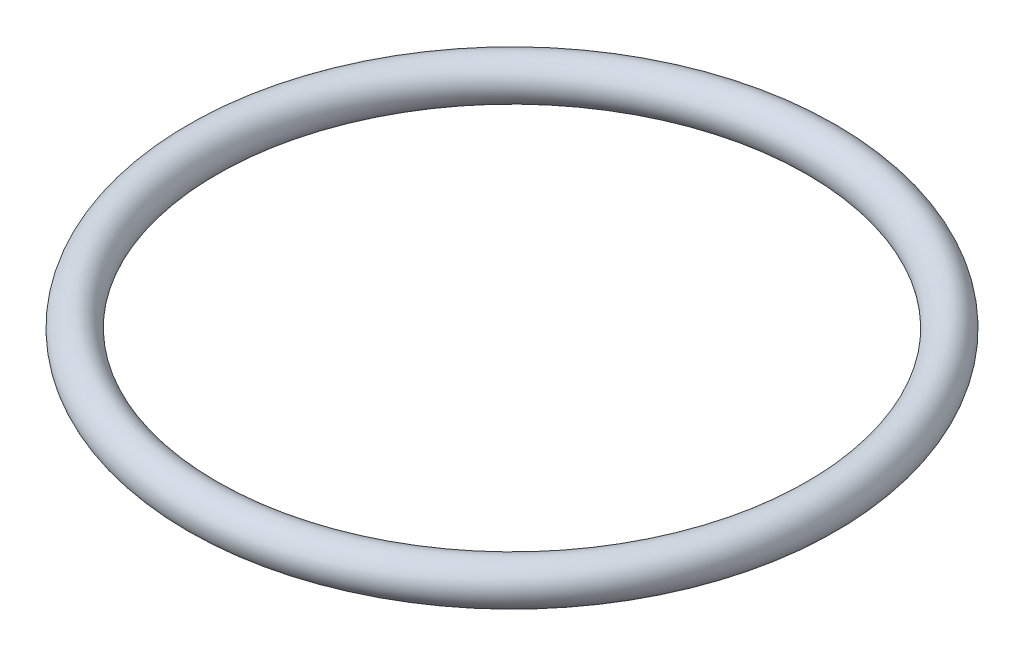
from build123d import *

# Parameters (mm, degrees)
SKETCH_1_R = 2


with BuildPart() as part:
    # ｽｹｯﾁ1 → 回転1 (revolve)
    with BuildSketch(Plane.XY, mode=Mode.PRIVATE) as revolve_1_sk:
        with Locations((30.5, 0)):
            Circle(SKETCH_1_R)
    revolve(revolve_1_sk.sketch.rotate(Axis((0, 0, 0), (0, 1, 0)), 90), axis=Axis((0, 0, 0), (0, 1, 0)))


solid = part.part
